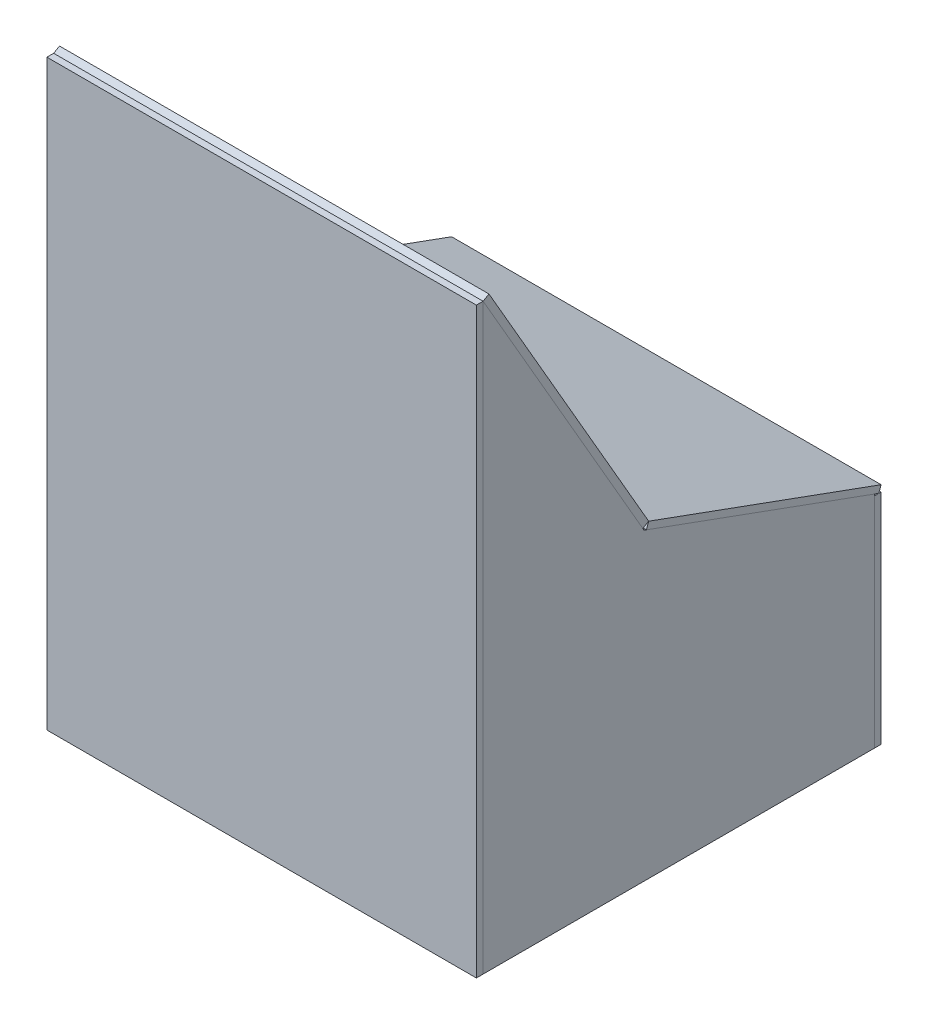
from build123d import *

# Parameters (mm, degrees)
ESQUISSE3_W                = 188
ESQUISSE3_H                = 174
PLQ_BASE_DEPTH             = 3
ESQUISSE4_W                = 191
ESQUISSE4_H                = 259.159718809
PLQ_ARRIERE_DEPTH          = 3
ESQUISSE5_W                = 191
ESQUISSE5_H                = 97.180922138
PLQ_AVANT_DEPTH            = 3
ESQUISSE6_W                = 142.071471004
ESQUISSE6_H                = 191
PLQ_PANNEAU_DESSUS_DEPTH   = 3
ESQUISSE11_W               = 110
ESQUISSE11_H               = 191
PLQ_TABLETTE_DEPTH         = 3
PLQ_COTE_START             = 191
PLQ_COTE_DEPTH             = 3
ESQUISSE9_R                = 22.5
FENTE_1_DEPTH              = 370.018781398
R_P_TITION_LIN_AIRE2_COUNT = 3
R_P_TITION_LIN_AIRE2_PITCH = 71
SEPARATEUR_1_START         = 106.5
ESQUISSE10_W               = 3
ESQUISSE10_H               = 20
ESQUISSE10_W_2             = 20
ESQUISSE10_H_2             = 3
ESQUISSE10_H_3             = 10
SEPARATEUR_1_DEPTH         = 1.5
SEPARATEUR_2_START         = 35.5
ESQUISSE10_3_W             = 3
ESQUISSE10_3_H             = 10
ESQUISSE10_3_W_2           = 20
ESQUISSE10_3_H_2           = 3
ESQUISSE10_3_H_3           = 20
SEPARATEUR_2_DEPTH         = 1.5
ESQUISSE13_W               = 188
ESQUISSE13_H               = 107.899377386
PLQ_SUPPORT_TABLETTE_DEPTH = 3


with BuildPart() as part:
    # Esquisse3 → plq_base (new body)
    with BuildSketch(Plane(origin=(0, 0, 0), x_dir=(1, 0, 0), z_dir=(0, 1, 0))):
        with Locations((94, -90)):
            Rectangle(ESQUISSE3_W, ESQUISSE3_H)
    extrude(amount=PLQ_BASE_DEPTH)


with BuildPart() as body_2:
    # Esquisse4 → plq_arriere (new body)
    with BuildSketch(Plane.XY.offset(180)):
        with Locations((95.5, 129.579859405)):
            Rectangle(ESQUISSE4_W, ESQUISSE4_H)
    extrude(amount=-PLQ_ARRIERE_DEPTH)


with BuildPart() as body_3:
    # Esquisse5 → plq_avant (new body)
    with BuildSketch(Plane.XY):
        with Locations((95.5, 48.590461069)):
            Rectangle(ESQUISSE5_W, ESQUISSE5_H)
    extrude(amount=PLQ_AVANT_DEPTH)


with BuildPart() as body_4:
    # Esquisse6 → plq_panneau (dessus) (new body)
    with BuildSketch(Plane(origin=(0, -11.853318533, 20.530549937), x_dir=(0, 0.8660254037844439, 0.4999999999999909), z_dir=(0, 0.4999999999999909, -0.8660254037844439))):
        with Locations((241.903164624, 95.5)):
            Rectangle(ESQUISSE6_W, ESQUISSE6_H)
    extrude(amount=PLQ_PANNEAU_DESSUS_DEPTH)

    # Esquisse9 → fente_1 (cut, through all)
    with BuildSketch(Plane(origin=(0, -11.853318533, 20.530549937), x_dir=(0, 0.8660254037844439, 0.4999999999999909), z_dir=(0, 0.4999999999999909, -0.8660254037844439))):
        with Locations((277.938900126, 142)):
            Circle(ESQUISSE9_R)
    fente_1 = extrude(amount=FENTE_1_DEPTH, mode=Mode.SUBTRACT)

    # Répétition linéaire2: fente_1 ×3
    with Locations(*[(-i * R_P_TITION_LIN_AIRE2_PITCH, 0, 0) for i in range(1, R_P_TITION_LIN_AIRE2_COUNT)]):
        add(fente_1, mode=Mode.SUBTRACT)


with BuildPart() as body_5:
    # Esquisse11 → plq_tablette (new body)
    with BuildSketch(Plane(origin=(0, 85.483144294, -31.113320054), x_dir=(0, -0.3420201433256655, -0.9396926207859096), z_dir=(0, -0.9396926207859095, 0.34202014332566544))):
        with Locations((-89.202014333, 95.5)):
            Rectangle(ESQUISSE11_W, ESQUISSE11_H)
    extrude(amount=-PLQ_TABLETTE_DEPTH)


with BuildPart() as body_6:
    # Esquisse7 → plq_cote (new body)
    with BuildSketch(Plane(origin=(0, 0, 0), x_dir=(0, 0, -1), z_dir=(1, 0, 0)).offset(PLQ_COTE_START)):
        Polygon((-177, 259.159718809), (-177, 0), (-3, 0), (-3, 97.899377385), (-105.418309146, 135.176593359), align=None)
    extrude(amount=-PLQ_COTE_DEPTH)


with BuildPart() as body_7:
    # Esquisse10 → separateur_1 (new, symmetric)
    with BuildSketch(Plane(origin=(0, 0, 0), x_dir=(0, 0, -1), z_dir=(1, 0, 0)).offset(SEPARATEUR_1_START)):
        Polygon((-170.75, 248.334401261), (-177, 259.159718809), (-177, 239.159718809), (-177, 219.159718809), (-177, 173.773145872), (-177, 153.773145872), (-177, 108.386572936), (-177, 88.386572936), (-177, 43), (-177, 23), (-177, 3), (-157, 3), (-137, 3), (-43, 3), (-23, 3), (-3, 3), (-3, 8), (-3, 18), (-3, 72.257599661), (-3, 82.257599661), (-3, 87.257599661), (-31.787808935, 97.735505223), (-50.581661351, 104.575908089), (-64.677050662, 109.706210239), (-83.470903078, 116.546613106), (-105.418309146, 124.534815634), (-105.418309146, 135.176593359), (-105.964264498, 136.122215766), (-108.418309146, 140.372745781), (-113.614461569, 137.372745781), (-155.632535537, 210.15018473), (-150.436383114, 213.15018473), align=None)
        with Locations((-178.5, 229.159718809)):
            Rectangle(ESQUISSE10_W, ESQUISSE10_H)
        with Locations((-178.5, 33)):
            Rectangle(ESQUISSE10_W, ESQUISSE10_H)
        with Locations((-147, 1.5)):
            Rectangle(ESQUISSE10_W_2, ESQUISSE10_H_2)
        with Locations((-33, 1.5)):
            Rectangle(ESQUISSE10_W_2, ESQUISSE10_H_2)
        with Locations((-1.5, 13)):
            Rectangle(ESQUISSE10_W, ESQUISSE10_H_3)
        with Locations((-1.5, 77.257599661)):
            Rectangle(ESQUISSE10_W, ESQUISSE10_H_3)
        Polygon((-82.444842648, 119.365690968), (-83.470903078, 116.546613106), (-64.677050662, 109.706210239), (-63.650990232, 112.525288101), align=None)
        Polygon((-49.555600921, 107.394985952), (-50.581661351, 104.575908089), (-31.787808935, 97.735505223), (-30.761748505, 100.554583085), align=None)
        with Locations((-178.5, 163.773145872)):
            Rectangle(ESQUISSE10_W, ESQUISSE10_H)
        with Locations((-178.5, 98.386572936)):
            Rectangle(ESQUISSE10_W, ESQUISSE10_H)
    extrude(amount=SEPARATEUR_1_DEPTH, both=True)


with BuildPart() as body_8:
    # Esquisse10<3> → separateur_2 (new, symmetric)
    with BuildSketch(Plane(origin=(0, 0, 0), x_dir=(0, 0, -1), z_dir=(1, 0, 0)).offset(SEPARATEUR_2_START)):
        Polygon((-105.418309146, 135.176593359), (-105.418309146, 124.534815634), (-3, 87.257599661), (-3, 3), (-177, 3), (-177, 259.159718809), (-150.436383114, 213.15018473), (-155.632535537, 210.15018473), (-113.614461569, 137.372745781), (-108.418309146, 140.372745781), align=None)
        Polygon((-82.444842648, 119.365690968), (-83.470903078, 116.546613106), (-64.677050662, 109.706210239), (-63.650990232, 112.525288101), align=None)
        with Locations((-1.5, 77.257599661)):
            Rectangle(ESQUISSE10_3_W, ESQUISSE10_3_H)
        with Locations((-1.5, 13)):
            Rectangle(ESQUISSE10_3_W, ESQUISSE10_3_H)
        with Locations((-33, 1.5)):
            Rectangle(ESQUISSE10_3_W_2, ESQUISSE10_3_H_2)
        with Locations((-147, 1.5)):
            Rectangle(ESQUISSE10_3_W_2, ESQUISSE10_3_H_2)
        with Locations((-178.5, 33)):
            Rectangle(ESQUISSE10_3_W, ESQUISSE10_3_H_3)
        with Locations((-178.5, 98.386572936)):
            Rectangle(ESQUISSE10_3_W, ESQUISSE10_3_H_3)
        with Locations((-178.5, 163.773145872)):
            Rectangle(ESQUISSE10_3_W, ESQUISSE10_3_H_3)
        with Locations((-178.5, 229.159718809)):
            Rectangle(ESQUISSE10_3_W, ESQUISSE10_3_H_3)
        Polygon((-49.555600921, 107.394985952), (-50.581661351, 104.575908089), (-31.787808935, 97.735505223), (-30.761748505, 100.554583085), align=None)
    extrude(amount=SEPARATEUR_2_DEPTH, both=True)


with BuildPart() as body_9:
    # Esquisse13 → plq support tablette (new body)
    with BuildSketch(Plane(origin=(0, 78.905295948, -28.719179051), x_dir=(-1, 0, 0), z_dir=(0, -0.9396926207859095, 0.3420201433256655))):
        with Locations((-94, -87.704534)):
            Rectangle(ESQUISSE13_W, ESQUISSE13_H)
    extrude(amount=PLQ_SUPPORT_TABLETTE_DEPTH)


solid = Compound([part.part, body_2.part, body_3.part, body_4.part, body_5.part, body_6.part, body_7.part, body_8.part, body_9.part])
